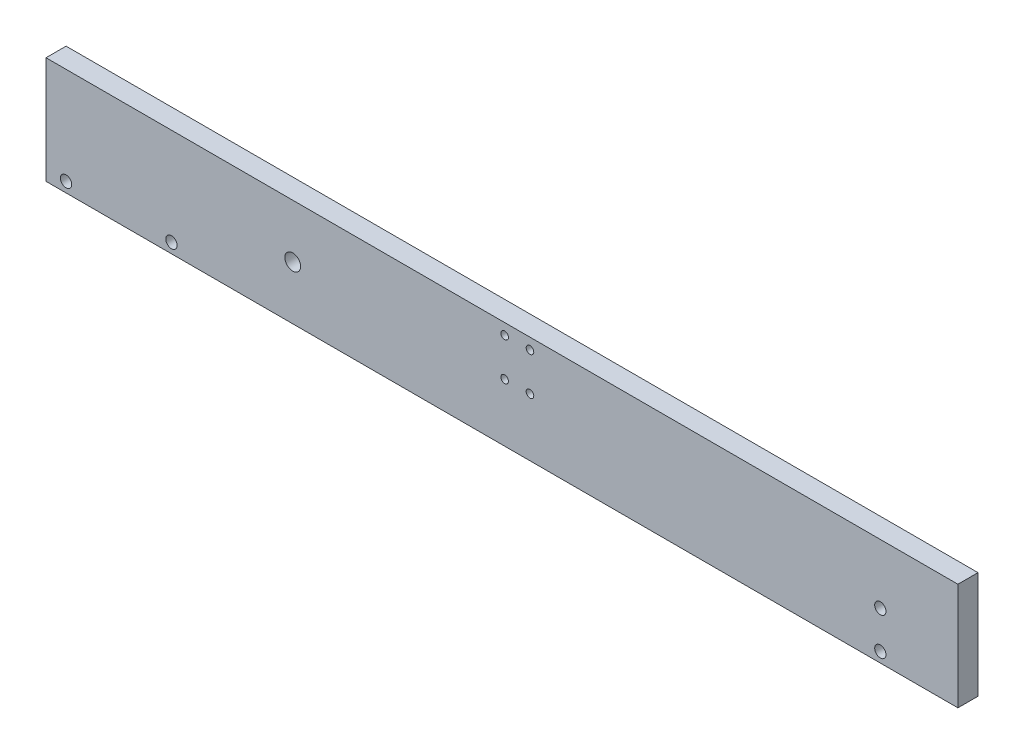
from build123d import *

# Parameters (mm, degrees)
SKETCH1_W           = 288.29
SKETCH1_H           = 33.85
SKETCH1_R           = 2.5
SKETCH1_R_2         = 1.2
SKETCH1_R_3         = 1.7859375
BOSS_EXTRUDE1_DEPTH = 6.35


with BuildPart() as part:
    # Sketch1 → Boss-Extrude1 (new body)
    with BuildSketch(Plane.XY):
        with Locations((-144.145, 16.925)):
            Rectangle(SKETCH1_W, SKETCH1_H)
        with Locations((-210.29, 16.925)):
            Circle(SKETCH1_R, mode=Mode.SUBTRACT)
        with Locations((-135.29, 18.35)):
            Circle(SKETCH1_R_2, mode=Mode.SUBTRACT)
        with Locations((-135.29, 30.35)):
            Circle(SKETCH1_R_2, mode=Mode.SUBTRACT)
        with Locations((-143.29, 18.35)):
            Circle(SKETCH1_R_2, mode=Mode.SUBTRACT)
        with Locations((-143.29, 30.35)):
            Circle(SKETCH1_R_2, mode=Mode.SUBTRACT)
        with Locations((-248.64, 3.175)):
            Circle(SKETCH1_R_3, mode=Mode.SUBTRACT)
        with Locations((-281.94, 3.175)):
            Circle(SKETCH1_R_3, mode=Mode.SUBTRACT)
        with Locations((-24.525, 15.025)):
            Circle(SKETCH1_R_3, mode=Mode.SUBTRACT)
        with Locations((-24.525, 3.175)):
            Circle(SKETCH1_R_3, mode=Mode.SUBTRACT)
    extrude(amount=BOSS_EXTRUDE1_DEPTH)


solid = part.part
